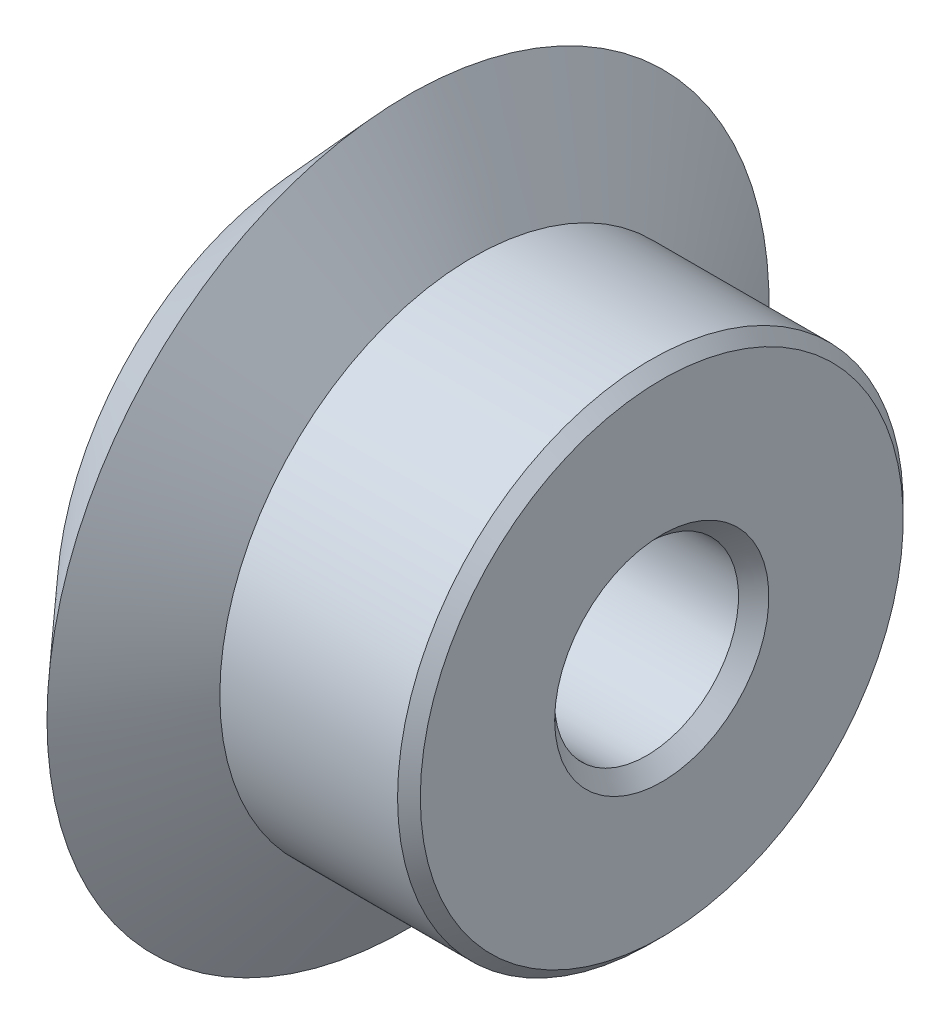
from build123d import *


with BuildPart() as part:
    # 草图1 → 旋转1 (revolve)
    with BuildSketch(Plane.XY, mode=Mode.PRIVATE) as revolve_1_sk:
        Polygon((-21, 0), (-21, 14.8), (-22.83, 16.669359971), (-16.56, 23.56), (-12.34, 16.5), (-0.74246212, 16.5), (0, 15.75753788), (0, 0), align=None)
    revolve(revolve_1_sk.sketch.rotate(Axis((0, 0, 0), (-1, 0, 0)), 270), axis=Axis((0, 0, 0), (-1, 0, 0)))

    # 草图2 → 切除-旋转1 (revolve, cut)
    with BuildSketch(Plane.XY, mode=Mode.PRIVATE) as cut_revolve_1_sk:
        Polygon((-21, 0), (-21, 6.99), (-20.01, 6), (-0.99, 6), (0, 6.99), (0, 0), align=None)
    revolve(cut_revolve_1_sk.sketch.rotate(Axis((0, 0, 0), (-1, 0, 0)), 270), axis=Axis((0, 0, 0), (-1, 0, 0)), mode=Mode.SUBTRACT)


solid = part.part
